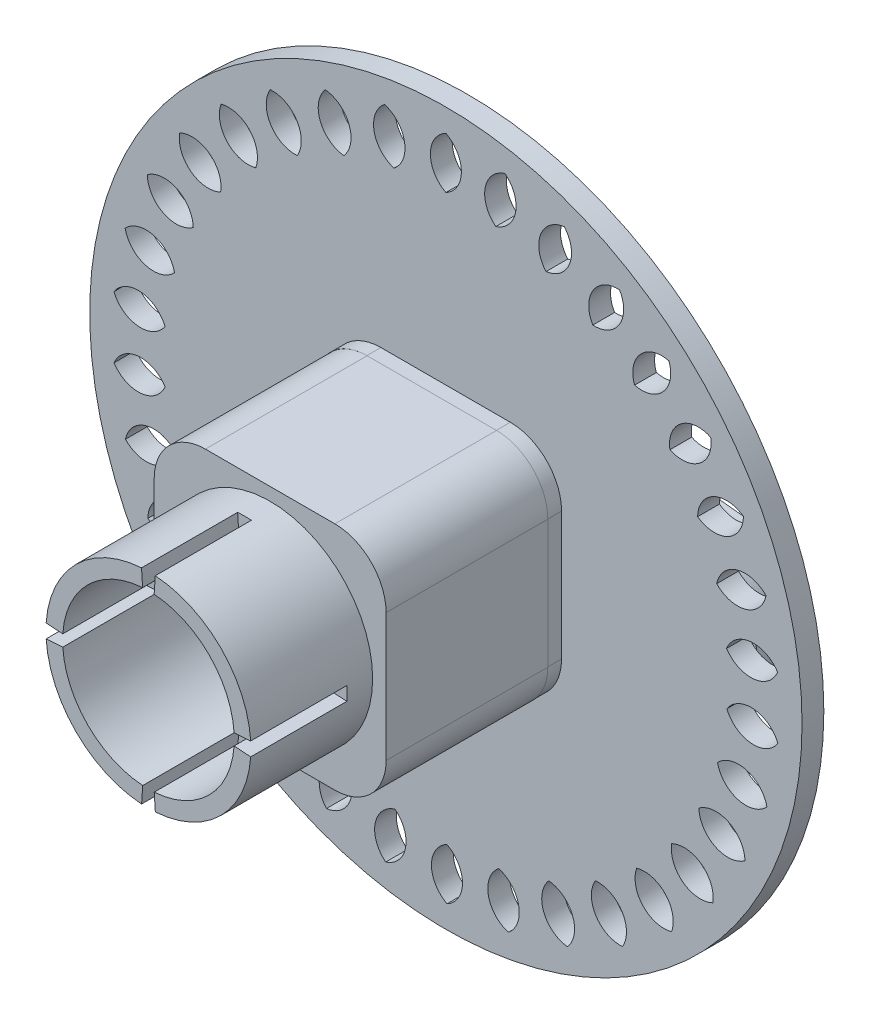
from build123d import *

# Parameters (mm, degrees)
BOSS_EXTRUDE1_DEPTH = 2
BOSS_EXTRUDE2_DEPTH = 11.02
BOSS_EXTRUDE3_DEPTH = 1.6
SKETCH4_R           = 8
BOSS_EXTRUDE4_DEPTH = 9.5
SKETCH5_R           = 6.65
CUT_EXTRUDE1_DEPTH  = 20
BOSS_EXTRUDE5_DEPTH = 1.095
SKETCH13_R          = 6.7
CUT_EXTRUDE3_DEPTH  = 30
CUT_EXTRUDE4_DEPTH  = 7.5
CIRPATTERN2_COUNT   = 4
BOSS_EXTRUDE6_DEPTH = 2.5
BOSS_EXTRUDE7_DEPTH = 4
SKETCH18_R          = 27.798521498
BOSS_EXTRUDE8_DEPTH = 1.7
CUT_EXTRUDE5_DEPTH  = 2.5
CIRPATTERN3_COUNT   = 34
CIRPATTERN3_ANGLE   = 349.8
SKETCH20_R          = 3.549409523
CUT_EXTRUDE6_DEPTH  = 3


with BuildPart() as part:
    # Sketch1 → Boss-Extrude1 (new body)
    with BuildSketch(Plane.XY):
        with BuildLine():
            Line((-5.05, 9.000108401), (5.05, 9.000108401))
            ThreePointArc((5.05, 9.000108401), (7.878427125, 7.828535526), (9.05, 5.000108401))
            Line((9.05, 5.000108401), (9.05, -5.000108401))
            ThreePointArc((9.05, -5.000108401), (7.878427125, -7.828535526), (5.05, -9.000108401))
            Line((5.05, -9.000108401), (-5.05, -9.000108401))
            ThreePointArc((-5.05, -9.000108401), (-7.878427125, -7.828535526), (-9.05, -5.000108401))
            Line((-9.05, -5.000108401), (-9.05, 5.000108401))
            ThreePointArc((-9.05, 5.000108401), (-7.878427125, 7.828535526), (-5.05, 9.000108401))
        make_face()
    extrude(amount=BOSS_EXTRUDE1_DEPTH)

    # Sketch2 → Boss-Extrude2 (add)
    with BuildSketch(Plane.XY):
        with BuildLine():
            Line((-5.05, 9.000108401), (5.05, 9.000108401))
            ThreePointArc((5.05, 9.000108401), (7.878427125, 7.828535526), (9.05, 5.000108401))
            Line((9.05, 5.000108401), (9.05, -5.000108401))
            ThreePointArc((9.05, -5.000108401), (7.878427125, -7.828535526), (5.05, -9.000108401))
            Line((5.05, -9.000108401), (-5.05, -9.000108401))
            ThreePointArc((-5.05, -9.000108401), (-7.878427125, -7.828535526), (-9.05, -5.000108401))
            Line((-9.05, -5.000108401), (-9.05, 5.000108401))
            ThreePointArc((-9.05, 5.000108401), (-7.878427125, 7.828535526), (-5.05, 9.000108401))
        make_face()
    extrude(amount=BOSS_EXTRUDE2_DEPTH)

    # Sketch3 → Boss-Extrude3 (add)
    with BuildSketch(Plane.XY.offset(11.02)):
        with BuildLine():
            Line((-5.05, 9.000108401), (5.05, 9.000108401))
            ThreePointArc((5.05, 9.000108401), (7.878427125, 7.828535526), (9.05, 5.000108401))
            Line((9.05, 5.000108401), (9.05, -5.000108401))
            ThreePointArc((9.05, -5.000108401), (7.878427125, -7.828535526), (5.05, -9.000108401))
            Line((5.05, -9.000108401), (-5.05, -9.000108401))
            ThreePointArc((-5.05, -9.000108401), (-7.878427125, -7.828535526), (-9.05, -5.000108401))
            Line((-9.05, -5.000108401), (-9.05, 5.000108401))
            ThreePointArc((-9.05, 5.000108401), (-7.878427125, 7.828535526), (-5.05, 9.000108401))
        make_face()
    extrude(amount=BOSS_EXTRUDE3_DEPTH)

    # Sketch4 → Boss-Extrude4 (add)
    with BuildSketch(Plane.XY.offset(12.62)):
        Circle(SKETCH4_R)
    extrude(amount=BOSS_EXTRUDE4_DEPTH)

    # Sketch5 → Cut-Extrude1 (cut)
    with BuildSketch(Plane.XY.offset(12.62)):
        Circle(SKETCH5_R)
    extrude(amount=CUT_EXTRUDE1_DEPTH, mode=Mode.SUBTRACT)

    # Sketch12 → Boss-Extrude5 (add)
    with BuildSketch(Plane(origin=(0, 0, 0), x_dir=(-1, 0, 0), z_dir=(0, 0, -1))):
        with BuildLine():
            Line((-5.027404416, 8.997340309), (5.072595584, 8.997340309))
            ThreePointArc((5.072595584, 8.997340309), (7.901022709, 7.825767433), (9.072595584, 4.997340309))
            Line((9.072595584, 4.997340309), (9.072595584, -5.002876493))
            ThreePointArc((9.072595584, -5.002876493), (7.901022709, -7.831303618), (5.072595584, -9.002876493))
            Line((5.072595584, -9.002876493), (-5.027404416, -9.002876493))
            ThreePointArc((-5.027404416, -9.002876493), (-7.85583154, -7.831303618), (-9.027404416, -5.002876493))
            Line((-9.027404416, -5.002876493), (-9.027404416, 4.997340309))
            ThreePointArc((-9.027404416, 4.997340309), (-7.85583154, 7.825767433), (-5.027404416, 8.997340309))
        make_face()
    extrude(amount=BOSS_EXTRUDE5_DEPTH)

    # Sketch13 → Cut-Extrude3 (cut, symmetric)
    with BuildSketch(Plane.XY):
        Circle(SKETCH13_R)
    extrude(amount=CUT_EXTRUDE3_DEPTH, both=True, mode=Mode.SUBTRACT)

    # Sketch15 → Cut-Extrude4 (cut)
    with BuildSketch(Plane.XY.offset(22.12)):
        Polygon((-0.552830798, 8.187091014), (-0.002830798, 0.003314653), (0.547169202, 8.187091014), (0.617169202, 9.000108401), (-0.626042329, 9.000108401), align=None)
    cut_extrude4 = extrude(amount=-CUT_EXTRUDE4_DEPTH, mode=Mode.SUBTRACT)

    # CirPattern2: Cut-Extrude4 ×4 about axis
    cirpattern2_axis = Axis((0, 0, 0), (0, 0, 1))
    for i in range(1, CIRPATTERN2_COUNT):
        add(cut_extrude4.rotate(cirpattern2_axis, i * 360 / CIRPATTERN2_COUNT), mode=Mode.SUBTRACT)



with BuildPart() as body_2:
    # Sketch16 → Boss-Extrude6 (new body)
    with BuildSketch(Plane(origin=(0, 0, -1.095), x_dir=(-1, 0, 0), z_dir=(0, 0, -1))):
        with BuildLine():
            Line((-5.0235757, 8.939451881), (5.076696464, 8.939451881))
            ThreePointArc((5.076696464, 8.939451881), (7.905123589, 7.767879006), (9.076696464, 4.939451881))
            Line((9.076696464, 4.939451881), (9.072595584, 4.856889481))
            Line((9.072595584, 4.856889481), (19.072595584, 4.856889481))
            Line((19.072595584, 4.856889481), (19.072595584, -4.825488195))
            Line((19.072595584, -4.825488195), (9.072595584, -4.825488195))
            Line((9.072595584, -4.825488195), (9.076550984, -4.98570964))
            ThreePointArc((9.076550984, -4.98570964), (7.907149741, -7.818099531), (5.076555683, -8.991841001))
            Line((5.076555683, -8.991841001), (-5.023434919, -8.991841001))
            ThreePointArc((-5.023434919, -8.991841001), (-7.854028977, -7.818099531), (-9.02343022, -4.98570964))
            Line((-9.02343022, -4.98570964), (-9.027404416, -4.784110513))
            Line((-9.027404416, -4.784110513), (-19.027404416, -4.784110513))
            Line((-19.027404416, -4.784110513), (-19.027404416, 4.856889481))
            Line((-19.027404416, 4.856889481), (-9.027404416, 4.856889481))
            Line((-9.027404416, 4.856889481), (-9.0235757, 4.939451881))
            ThreePointArc((-9.0235757, 4.939451881), (-7.852002825, 7.767879006), (-5.0235757, 8.939451881))
        make_face()
    extrude(amount=BOSS_EXTRUDE6_DEPTH)

    # Sketch17 → Boss-Extrude7 (add)
    with BuildSketch(Plane(origin=(0, 0, -3.595), x_dir=(-1, 0, 0), z_dir=(0, 0, -1))):
        with BuildLine():
            Line((0, 7), (-19, 5))
            ThreePointArc((-19, 5), (-21.800833997, 0), (-19, -5))
            Line((-19, -5), (0, -7))
            Line((0, -7), (19, -7))
            Line((19, -7), (16, -3.8))
            Line((16, -3.8), (0, -3.7))
            Line((0, -3.7), (-16, -2.2))
            ThreePointArc((-16, -2.2), (-17.416609195, 0), (-16, 2.2))
            Line((-16, 2.2), (0, 3.7))
            Line((0, 3.7), (16, 3.8))
            Line((16, 3.8), (19, 7))
            Line((19, 7), (0, 7))
        make_face()
    extrude(amount=BOSS_EXTRUDE7_DEPTH)


with BuildPart() as part_1:
    add(part.part)

    add(body_2.part)  # Boss-Extrude8 merges body 2
    # Sketch18 → Boss-Extrude8 (add)
    with BuildSketch(Plane.XY.offset(-1.095)):
        Circle(SKETCH18_R)
    extrude(amount=-BOSS_EXTRUDE8_DEPTH)

    # Sketch19 → Cut-Extrude5 (cut)
    with BuildSketch(Plane.XY.offset(-1.095)):
        with BuildLine():
            ThreePointArc((0, 26.016751488), (1.210186047, 24.013461717), (0, 22.010171947))
            ThreePointArc((0, 22.010171947), (-1.210186047, 24.013461717), (0, 26.016751488))
        make_face()
    cut_extrude5 = extrude(amount=-CUT_EXTRUDE5_DEPTH, mode=Mode.SUBTRACT)

    # CirPattern3: Cut-Extrude5 ×34 about axis
    cirpattern3_axis = Axis((0, 0, 0), (0, 0, 1))
    for i in range(1, CIRPATTERN3_COUNT):
        add(cut_extrude5.rotate(cirpattern3_axis, i * CIRPATTERN3_ANGLE / (CIRPATTERN3_COUNT - 1)), mode=Mode.SUBTRACT)

    # Sketch20 → Cut-Extrude6 (cut)
    with BuildSketch(Plane(origin=(0, 0, -3.595), x_dir=(-1, 0, 0), z_dir=(0, 0, -1))):
        Circle(SKETCH20_R)
    extrude(amount=-CUT_EXTRUDE6_DEPTH, mode=Mode.SUBTRACT)


solid = part_1.part
